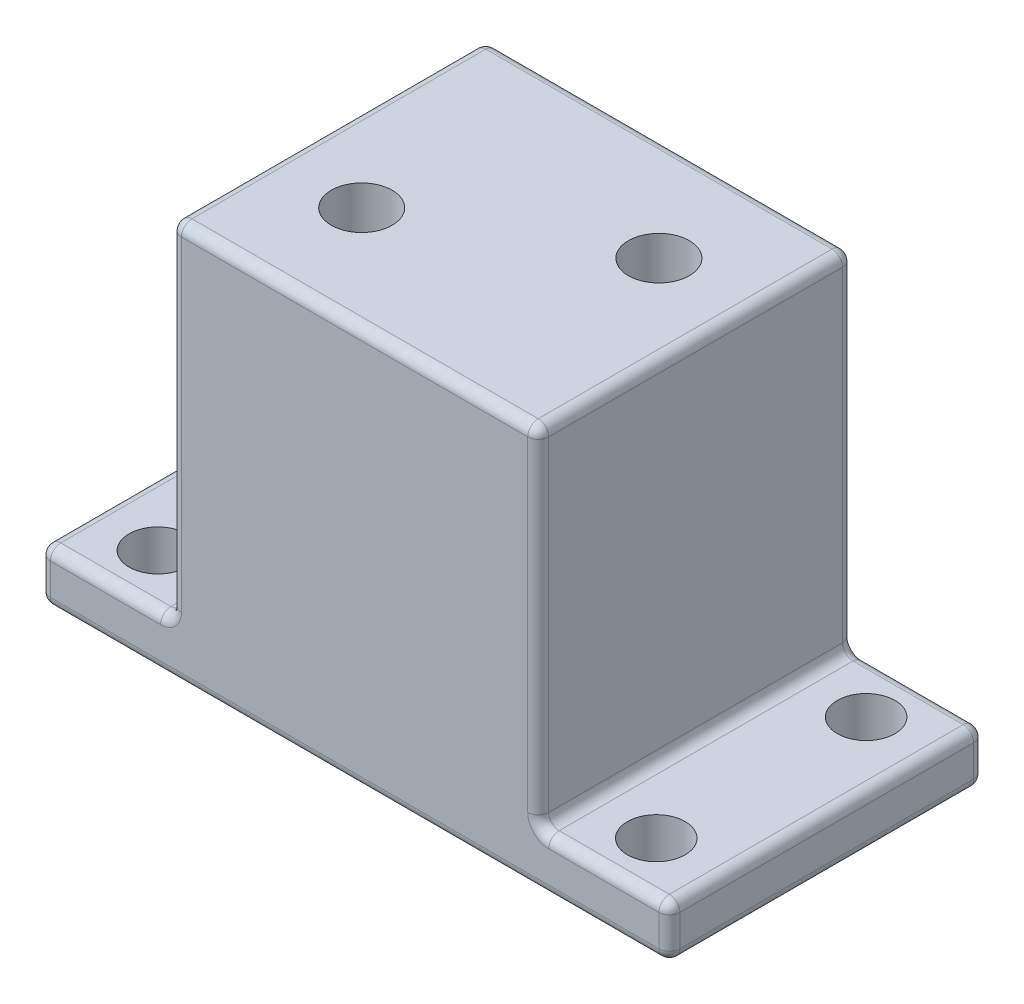
from build123d import *

# Parameters (mm, degrees)
SKETCH2_W           = 60
SKETCH2_H           = 30
BOSS_EXTRUDE1_DEPTH = 5
SKETCH3_W           = 35
SKETCH3_H           = 30
BOSS_EXTRUDE2_DEPTH = 33
SKETCH5_R           = 2.9
CUT_EXTRUDE1_DEPTH  = 20
SKETCH6_R           = 2.75
CUT_EXTRUDE2_DEPTH  = 75.759614766
FILLET1_R           = 1


with BuildPart() as part:
    # Sketch2 → Boss-Extrude1 (new body)
    with BuildSketch(Plane(origin=(0, 0, 0), x_dir=(1, 0, 0), z_dir=(0, 1, 0))):
        with Locations((-30, -15)):
            Rectangle(SKETCH2_W, SKETCH2_H)
    extrude(amount=BOSS_EXTRUDE1_DEPTH)

    # Sketch3 → Boss-Extrude2 (add)
    with BuildSketch(Plane(origin=(0, 5, 0), x_dir=(1, 0, 0), z_dir=(0, 1, 0))):
        with Locations((-30, -15)):
            Rectangle(SKETCH3_W, SKETCH3_H)
    extrude(amount=BOSS_EXTRUDE2_DEPTH)

    # Sketch5 → Cut-Extrude1 (cut)
    with BuildSketch(Plane(origin=(0, 38, 0), x_dir=(1, 0, 0), z_dir=(0, 1, 0))):
        with Locations(Location((-21, -10, 0), (0, 0, 270))):
            Circle(SKETCH5_R)
        with Locations(Location((-39.325, -20, 0), (0, 0, 270))):
            Circle(SKETCH5_R)
    extrude(amount=-CUT_EXTRUDE1_DEPTH, mode=Mode.SUBTRACT)

    # Sketch6 → Cut-Extrude2 (cut, through all)
    with BuildSketch(Plane(origin=(0, 5, 0), x_dir=(1, 0, 0), z_dir=(0, 1, 0))):
        with Locations(Location((-6.25, -5, 0), (0, 0, 270))):
            Circle(SKETCH6_R)
        with Locations(Location((-6.25, -25, 0), (0, 0, 270))):
            Circle(SKETCH6_R)
        with Locations(Location((-53.75, -25, 0), (0, 0, 270))):
            Circle(SKETCH6_R)
        with Locations(Location((-53.75, -5, 0), (0, 0, 270))):
            Circle(SKETCH6_R)
    extrude(amount=-CUT_EXTRUDE2_DEPTH, mode=Mode.SUBTRACT)

    # Fillet1
    fillet1_edges = [part.edges().sort_by_distance(p)[0] for p in [
        (-60, 5, 15),
        (-53.75, 5, 0),
        (-6.25, 5, 30),
        (-53.75, 5, 30),
        (-12.5, 5, 15),
        (-12.5, 21.5, 30),
        (-12.5, 21.5, 0),
        (-47.5, 5, 15),
        (-47.5, 21.5, 0),
        (-47.5, 21.5, 30),
        (-12.5, 38, 15),
        (-30, 38, 0),
        (-47.5, 38, 15),
        (-30, 38, 30),
        (0, 5, 15),
        (-30, 0, 30),
        (-60, 0, 15),
        (-30, 0, 0),
        (0, 0, 15),
        (0, 2.5, 30),
        (-60, 2.5, 30),
        (-60, 2.5, 0),
        (0, 2.5, 0),
        (-6.25, 5, 0),
    ]]
    fillet(fillet1_edges, radius=FILLET1_R)


solid = part.part
